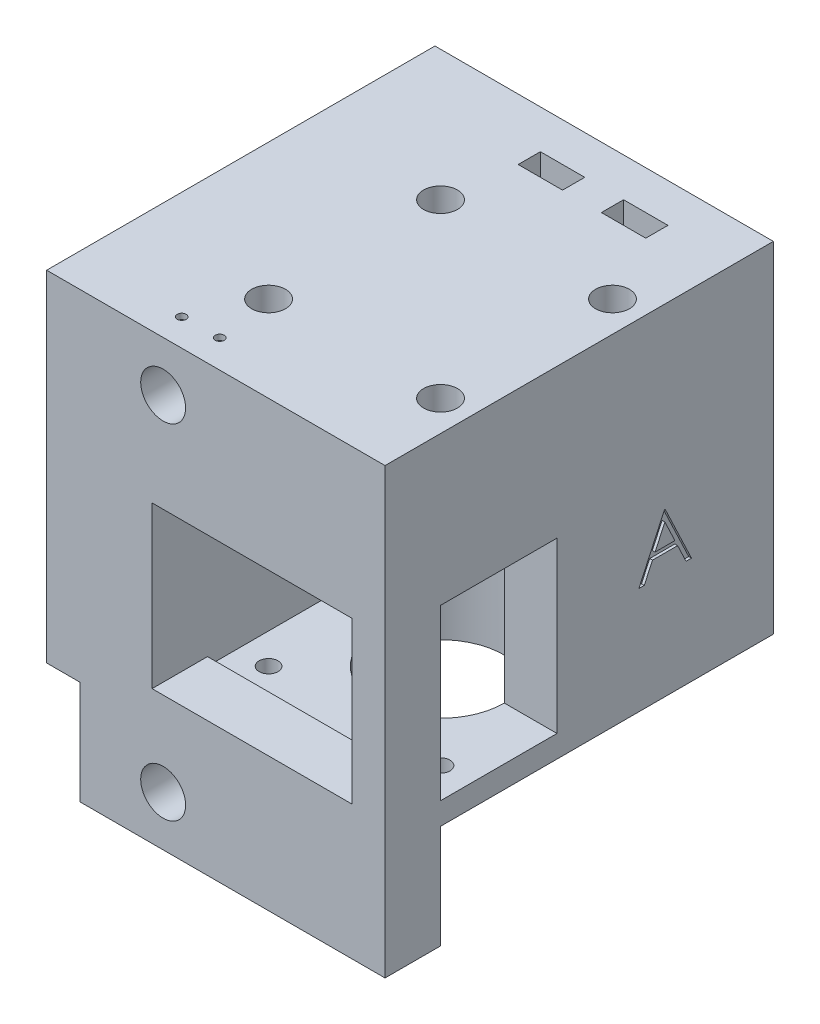
from build123d import *

# Parameters (mm, degrees)
SKETCH1_W           = 42
SKETCH1_H           = 42
SKETCH1_R           = 1.7
SKETCH1_R_2         = 11.5
BOSS_EXTRUDE1_DEPTH = 4
SKETCH2_W           = 55
SKETCH2_H           = 80
SKETCH2_R           = 4.05
SKETCH2_W_2         = 36
SKETCH2_H_2         = 29
BOSS_EXTRUDE2_DEPTH = 10
BOSS_EXTRUDE4_DEPTH = 30.5
SKETCH5_W           = 42
SKETCH5_H           = 26.825
BOSS_EXTRUDE5_DEPTH = 42
SKETCH6_R           = 1.7
CUT_EXTRUDE1_DEPTH  = 83.547898974
SKETCH7_R           = 3.05
CUT_EXTRUDE2_DEPTH  = 56.825
SKETCH3_R           = 4.05
BOSS_EXTRUDE7_DEPTH = 3
SKETCH8_R           = 0.8
CUT_EXTRUDE3_DEPTH  = 1
BOSS_EXTRUDE8_DEPTH = 61.325
SKETCH10_R          = 2
CUT_EXTRUDE4_DEPTH  = 5
SKETCH11_R          = 2.25
CUT_EXTRUDE5_DEPTH  = 14
SKETCH12_W          = 8
SKETCH12_H          = 4
CUT_EXTRUDE6_DEPTH  = 13
CUT_EXTRUDE7_DEPTH  = 0.5


with BuildPart() as part:
    # Sketch1 → Boss-Extrude1 (new body)
    with BuildSketch(Plane(origin=(0, 0, 0), x_dir=(1, 0, 0), z_dir=(0, 1, 0))):
        with Locations((21, 21)):
            Rectangle(SKETCH1_W, SKETCH1_H)
        with Locations(Location((5.5, 36.5, 0), (0, 0, 270))):
            Circle(SKETCH1_R, mode=Mode.SUBTRACT)
        with Locations(Location((36.5, 36.5, 0), (0, 0, 270))):
            Circle(SKETCH1_R, mode=Mode.SUBTRACT)
        with Locations(Location((5.5, 5.5, 0), (0, 0, 270))):
            Circle(SKETCH1_R, mode=Mode.SUBTRACT)
        with Locations(Location((36.5, 5.5, 0), (0, 0, 270))):
            Circle(SKETCH1_R, mode=Mode.SUBTRACT)
        with Locations(Location((21, 21, 0), (0, 0, 270))):
            Circle(SKETCH1_R_2, mode=Mode.SUBTRACT)
    extrude(amount=BOSS_EXTRUDE1_DEPTH)

    # Sketch2 → Boss-Extrude2 (add)
    with BuildSketch(Plane.XY):
        with Locations((14.5, 21.325)):
            Rectangle(SKETCH2_W, SKETCH2_H)
        with Locations((2, 52.325)):
            Circle(SKETCH2_R, mode=Mode.SUBTRACT)
        with Locations((2, -9.675)):
            Circle(SKETCH2_R, mode=Mode.SUBTRACT)
        with Locations((18, 20)):
            Rectangle(SKETCH2_W_2, SKETCH2_H_2, mode=Mode.SUBTRACT)
    extrude(amount=BOSS_EXTRUDE2_DEPTH)

    # Sketch4 → Boss-Extrude4 (add)
    with BuildSketch(Plane(origin=(0, 4, 0), x_dir=(1, 0, 0), z_dir=(0, 1, 0))):
        with BuildLine():
            Line((0, 21), (9.5, 21))
            ThreePointArc((9.5, 21), (21, 32.5), (32.5, 21))
            Line((32.5, 21), (42, 21))
            Line((42, 21), (42, 42))
            Line((42, 42), (0, 42))
            Line((0, 42), (0, 21))
        make_face()
    extrude(amount=BOSS_EXTRUDE4_DEPTH)

    # Sketch5 → Boss-Extrude5 (add)
    with BuildSketch(Plane(origin=(0, 0, 0), x_dir=(-1, 0, 0), z_dir=(0, 0, -1))):
        with Locations((-21, 47.9125)):
            Rectangle(SKETCH5_W, SKETCH5_H)
    extrude(amount=BOSS_EXTRUDE5_DEPTH)

    # Sketch6 → Cut-Extrude1 (cut, through all)
    with BuildSketch(Plane.XZ.offset(-4)):
        with Locations(Location((5.5, -36.5, 0), (0, 0, 270))):
            Circle(SKETCH6_R)
        with Locations(Location((36.5, -36.5, 0), (0, 0, 270))):
            Circle(SKETCH6_R)
    extrude(amount=-CUT_EXTRUDE1_DEPTH, mode=Mode.SUBTRACT)

    # Sketch7 → Cut-Extrude2 (cut)
    with BuildSketch(Plane(origin=(0, 61.325, 0), x_dir=(1, 0, 0), z_dir=(0, 1, 0))):
        with Locations(Location((5.5, 36.5, 0), (0, 0, 180))):
            Circle(SKETCH7_R)
        with Locations(Location((36.5, 36.5, 0), (0, 0, 180))):
            Circle(SKETCH7_R)
        with Locations(Location((5.5, 5.5, 0), (0, 0, 180))):
            Circle(SKETCH7_R)
        with Locations(Location((36.5, 5.5, 0), (0, 0, 180))):
            Circle(SKETCH7_R)
    extrude(amount=-CUT_EXTRUDE2_DEPTH, mode=Mode.SUBTRACT)

    # Sketch3 → Boss-Extrude7 (add)
    with BuildSketch(Plane(origin=(0, 0, 0), x_dir=(-1, 0, 0), z_dir=(0, 0, -1))):
        with Locations((-2, -9.675)):
            Circle(SKETCH3_R)
        with Locations((-2, 52.325)):
            Circle(SKETCH3_R)
    extrude(amount=-BOSS_EXTRUDE7_DEPTH)

    # Sketch8 → Cut-Extrude3 (cut)
    with BuildSketch(Plane(origin=(0, 61.325, 0), x_dir=(1, 0, 0), z_dir=(0, 1, 0))):
        with Locations(Location((0.450490451, -5.1, 0), (0, 0, 180))):
            Circle(SKETCH8_R)
        with Locations(Location((7.148741473, -4.946920802, 0), (0, 0, 180))):
            Circle(SKETCH8_R)
    extrude(amount=-CUT_EXTRUDE3_DEPTH, mode=Mode.SUBTRACT)

    # Sketch9 → Boss-Extrude8 (add)
    with BuildSketch(Plane(origin=(0, 61.325, 0), x_dir=(1, 0, 0), z_dir=(0, 1, 0))):
        Polygon((-13, -10), (-19, -10), (-19, 60), (42, 60), (42, 42), (0, 42), (0, 0), (-13, 0), align=None)
    extrude(amount=-BOSS_EXTRUDE8_DEPTH)

    # Sketch10 → Cut-Extrude4 (cut)
    with BuildSketch(Plane.XZ):
        with Locations(Location((-6.5, -52.5, 0), (0, 0, 270))):
            Circle(SKETCH10_R)
        with Locations(Location((-6.5, -37.5, 0), (0, 0, 270))):
            Circle(SKETCH10_R)
    extrude(amount=-CUT_EXTRUDE4_DEPTH, mode=Mode.SUBTRACT)

    # Sketch11 → Cut-Extrude5 (cut)
    with BuildSketch(Plane(origin=(0, 0, -60), x_dir=(-1, 0, 0), z_dir=(0, 0, -1))):
        with Locations((-26, 53.325)):
            Circle(SKETCH11_R)
        with Locations((-11, 53.325)):
            Circle(SKETCH11_R)
    extrude(amount=-CUT_EXTRUDE5_DEPTH, mode=Mode.SUBTRACT)

    # Sketch12 → Cut-Extrude6 (cut)
    with BuildSketch(Plane(origin=(0, 61.325, 0), x_dir=(1, 0, 0), z_dir=(0, 1, 0))):
        with Locations((11, 51)):
            Rectangle(SKETCH12_W, SKETCH12_H)
        with Locations((26, 51)):
            Rectangle(SKETCH12_W, SKETCH12_H)
    extrude(amount=-CUT_EXTRUDE6_DEPTH, mode=Mode.SUBTRACT)

    # Sketch13 → Cut-Extrude7 (cut)
    with BuildSketch(Plane(origin=(42, 0, 0), x_dir=(0, 0, -1), z_dir=(1, 0, 0))):
        Polygon((40.371794872, 29.25), (35.756410256, 19.25), (36.731971154, 19.25), (38.210336538, 22.455128205), (42.743589744, 22.455128205), (44.264022436, 19.25), (45.243589744, 19.25), (40.5, 29.25), align=None)
        Polygon((40.445913462, 27.30088141), (42.256810897, 23.480769231), (38.683092949, 23.480769231), align=None, mode=Mode.SUBTRACT)
    extrude(amount=-CUT_EXTRUDE7_DEPTH, mode=Mode.SUBTRACT)


solid = part.part
